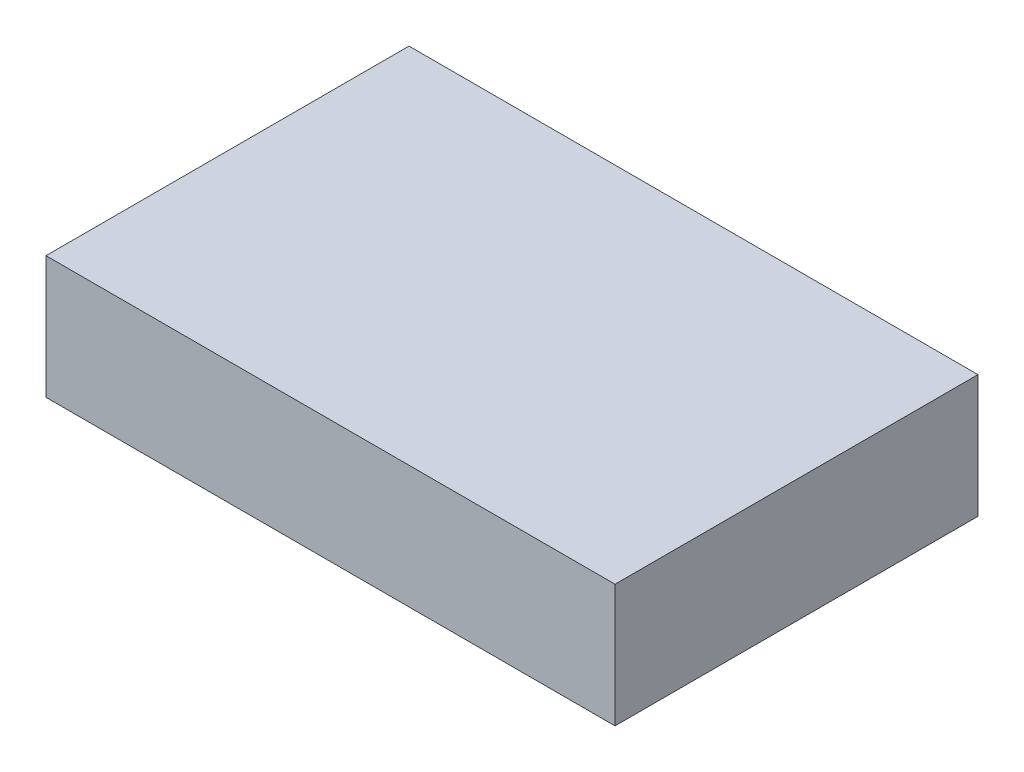
from build123d import *

# Parameters (mm, degrees)
SKETCH_1_W      = 88.1
SKETCH_1_H      = 56.2
EXTRUDE_1_DEPTH = 19


with BuildPart() as part:
    # 草圖1 → 填料-伸長1 (new body)
    with BuildSketch(Plane(origin=(0, 0, 0), x_dir=(1, 0, 0), z_dir=(0, 1, 0))):
        Rectangle(SKETCH_1_W, SKETCH_1_H)
    extrude(amount=EXTRUDE_1_DEPTH)


solid = part.part
